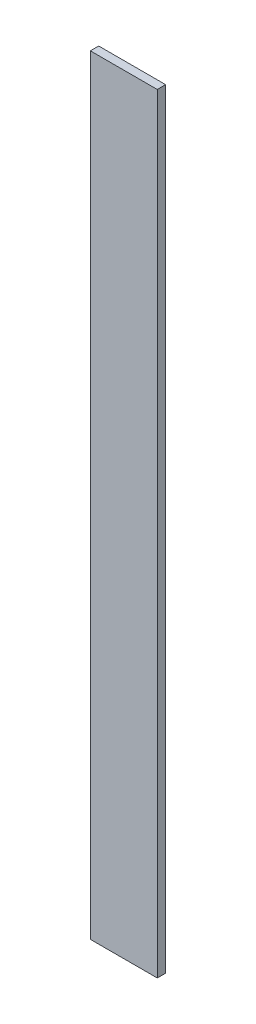
from build123d import *

# Parameters (mm, degrees)
ESQUISSE1_W        = 50.8
ESQUISSE1_H        = 584.2
BOSS_EXTRU_1_DEPTH = 6.35


with BuildPart() as part:
    # Esquisse1 → Boss.-Extru.1 (new body)
    with BuildSketch(Plane.XY):
        Rectangle(ESQUISSE1_W, ESQUISSE1_H)
    extrude(amount=BOSS_EXTRU_1_DEPTH)


solid = part.part
